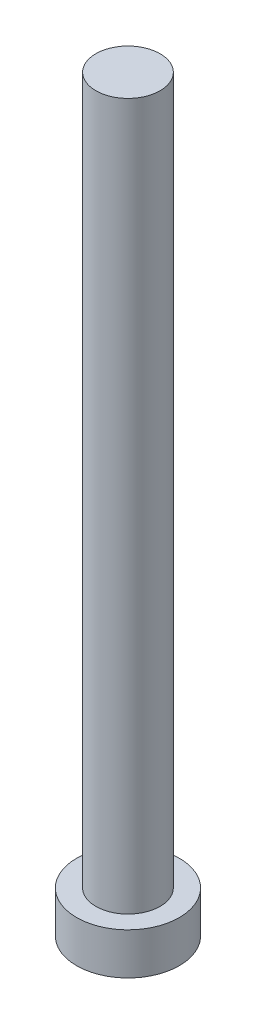
from build123d import *

# Parameters (mm, degrees)
SKETCH_1_R      = 1.6
EXTRUDE_1_DEPTH = 1.3
EXTRUDE_START   = 1.3
SKETCH_2_R      = 1
EXTRUDE_2_DEPTH = 22


with BuildPart() as part:
    # 草图1 → 凸台-拉伸1 (new body)
    with BuildSketch(Plane(origin=(0, 0, 0), x_dir=(1, 0, 0), z_dir=(0, 1, 0))):
        with Locations(Location((0, 0, 0), (0, 0, 270))):
            Circle(SKETCH_1_R)
    extrude(amount=EXTRUDE_1_DEPTH)

    # 草图2 → 凸台-拉伸2 (add)
    with BuildSketch(Plane(origin=(0, 0, 0), x_dir=(1, 0, 0), z_dir=(0, 1, 0)).offset(EXTRUDE_START)):
        with Locations(Location((0, 0, 0), (0, 0, 270))):
            Circle(SKETCH_2_R)
    extrude(amount=EXTRUDE_2_DEPTH)


solid = part.part
